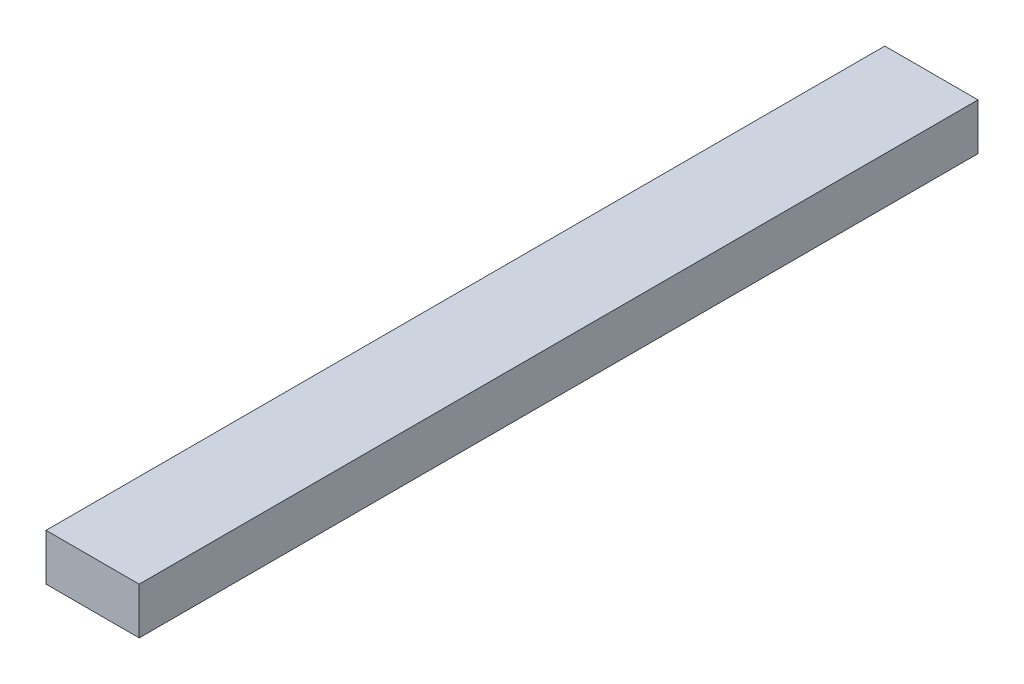
from build123d import *

# Parameters (mm, degrees)
SKETCH1_W           = 101.6
SKETCH1_H           = 50.8
BOSS_EXTRUDE1_DEPTH = 914.4


with BuildPart() as part:
    # Sketch1 → Boss-Extrude1 (new body)
    with BuildSketch(Plane.XY):
        with Locations((50.8, 25.4)):
            Rectangle(SKETCH1_W, SKETCH1_H)
    extrude(amount=BOSS_EXTRUDE1_DEPTH)


solid = part.part
